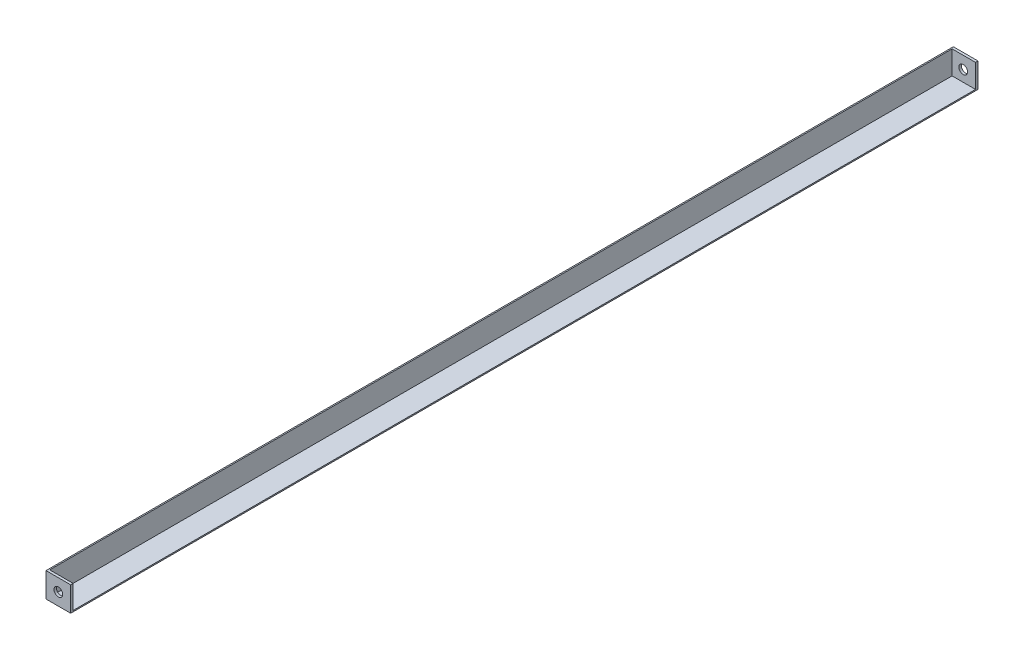
from build123d import *

# Parameters (mm, degrees)
BOSS_EXTRUDE1_DEPTH = 584.2
BOSS_EXTRUDE2_START = 584.2
SKETCH2_W           = 31.75
SKETCH2_H           = 31.75
SKETCH2_R           = 5.588
BOSS_EXTRUDE2_DEPTH = 3.175


with BuildPart() as part:
    # Sketch1 → Boss-Extrude1 (new, symmetric)
    with BuildSketch(Plane.XY):
        Polygon((31.75, 1.5875), (1.5875, 1.5875), (1.5875, 31.75), (0, 31.75), (0, 0), (31.75, 0), align=None)
    extrude(amount=BOSS_EXTRUDE1_DEPTH, both=True)

    # Sketch2 → Boss-Extrude2 (add)
    with BuildSketch(Plane.XY.offset(BOSS_EXTRUDE2_START)):
        with Locations((15.875, 15.875)):
            Rectangle(SKETCH2_W, SKETCH2_H)
        with Locations((15.875, 15.875)):
            Circle(SKETCH2_R, mode=Mode.SUBTRACT)
    boss_extrude2 = extrude(amount=-BOSS_EXTRUDE2_DEPTH)

    # Mirror1: Boss-Extrude2 across plane
    add(boss_extrude2.mirror(Plane.XY))


solid = part.part
